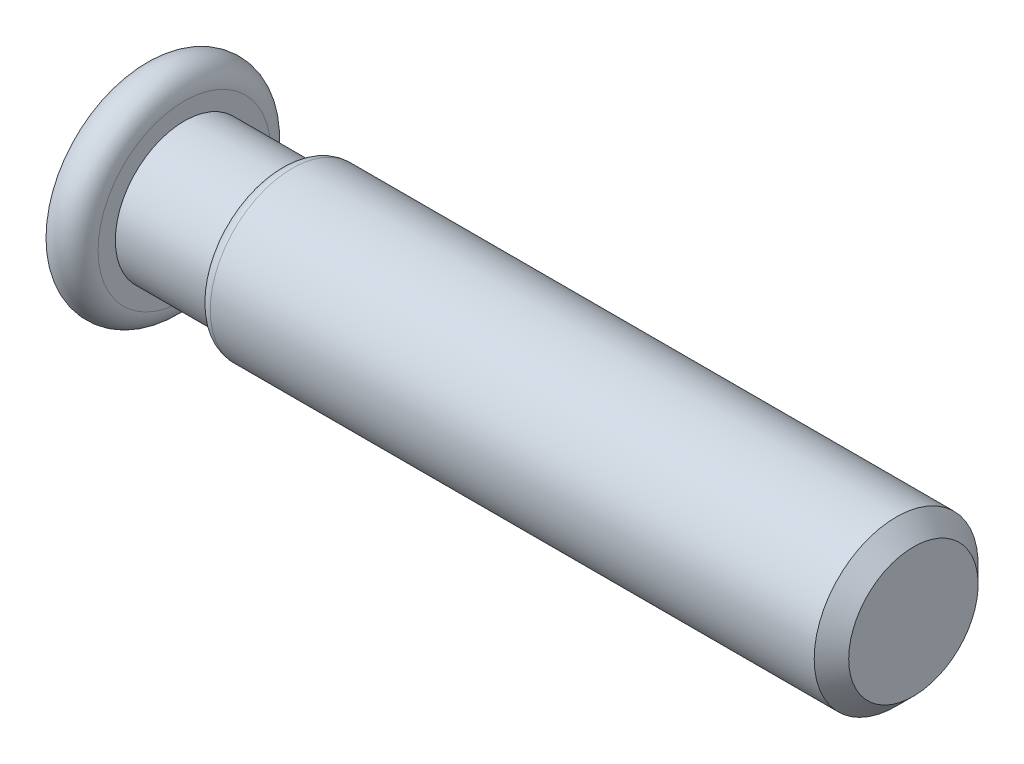
from build123d import *


with BuildPart() as part:
    # Sketch1 → Revolve1 (revolve)
    with BuildSketch(Plane.XY, mode=Mode.PRIVATE) as revolve1_sk:
        with BuildLine():
            Line((0, 0), (0, 10))
            ThreePointArc((0, 10), (2.5, 12.5), (5, 10))
            Line((5, 10), (5, 8))
            Line((5, 8), (16, 8))
            ThreePointArc((16, 8), (16.439339828, 9.060660172), (17.5, 9.5))
            Line((17.5, 9.5), (87.5, 9.5))
            Line((87.5, 9.5), (89.5, 7.5))
            Line((89.5, 7.5), (89.5, 0))
            Line((89.5, 0), (0, 0))
        make_face()
    revolve(revolve1_sk.sketch.rotate(Axis((0, 0, 0), (1, 0, 0)), 90), axis=Axis((0, 0, 0), (1, 0, 0)))


solid = part.part
